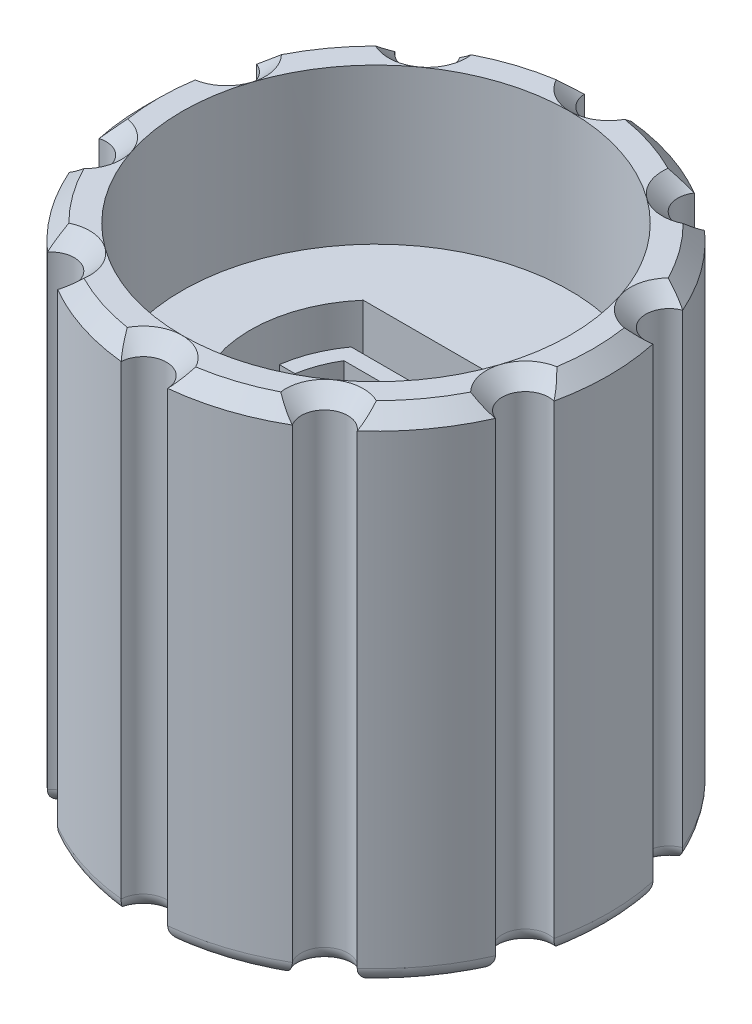
from build123d import *

# Parameters (mm, degrees)
SKETCH1_R           = 7.5
BOSS_EXTRUDE1_DEPTH = 16
CUT_EXTRUDE3_DEPTH  = 20.19635382
CHAMFER1_SIZE       = 0.5
FILLET1_R           = 0.5
CUT_EXTRUDE4_DEPTH  = 14
BOSS_EXTRUDE2_DEPTH = 8
SKETCH7_R           = 6.25
CUT_EXTRUDE5_DEPTH  = 5


with BuildPart() as part:
    # Sketch1 → Boss-Extrude1 (new body)
    with BuildSketch(Plane(origin=(0, 0, 0), x_dir=(1, 0, 0), z_dir=(0, 1, 0))):
        with Locations(Location((0, 0, 0), (0, 0, 270))):
            Circle(SKETCH1_R)
    extrude(amount=BOSS_EXTRUDE1_DEPTH)

    # Sketch4 → Cut-Extrude3 (cut, through all)
    with BuildSketch(Plane(origin=(0, 16, 0), x_dir=(1, 0, 0), z_dir=(0, 1, 0))):
        with BuildLine():
            ThreePointArc((-3.780343628, 6.477576866), (-4.408389392, 6.067627458), (-4.992351263, 5.597001775))
            ThreePointArc((-4.992351263, 5.597001775), (-3.967550453, 5.460864712), (-3.780343628, 6.477576866))
        make_face()
        with BuildLine():
            ThreePointArc((0.749061913, 7.4625), (0, 7.5), (-0.749061913, 7.4625))
            ThreePointArc((-0.749061913, 7.4625), (0, 6.75), (0.749061913, 7.4625))
        make_face()
        with BuildLine():
            ThreePointArc((3.780343628, 6.477576866), (3.967550453, 5.460864712), (4.992351263, 5.597001775))
            ThreePointArc((4.992351263, 5.597001775), (4.408389392, 6.067627458), (3.780343628, 6.477576866))
        make_face()
        with BuildLine():
            ThreePointArc((6.865786392, 3.018439534), (6.419631485, 2.085864712), (7.328732114, 1.593639107))
            ThreePointArc((7.328732114, 1.593639107), (7.132923872, 2.317627458), (6.865786392, 3.018439534))
        make_face()
        with BuildLine():
            ThreePointArc((7.328732114, -1.593639107), (6.419631485, -2.085864712), (6.865786392, -3.018439534))
            ThreePointArc((6.865786392, -3.018439534), (7.132923872, -2.317627458), (7.328732114, -1.593639107))
        make_face()
        with BuildLine():
            ThreePointArc((4.992351263, -5.597001775), (3.967550453, -5.460864712), (3.780343628, -6.477576866))
            ThreePointArc((3.780343628, -6.477576866), (4.408389392, -6.067627458), (4.992351263, -5.597001775))
        make_face()
        with BuildLine():
            ThreePointArc((-0.749061913, -7.4625), (0, -7.5), (0.749061913, -7.4625))
            ThreePointArc((0.749061913, -7.4625), (0, -6.75), (-0.749061913, -7.4625))
        make_face()
        with BuildLine():
            ThreePointArc((-4.992351263, -5.597001775), (-4.408389392, -6.067627458), (-3.780343628, -6.477576866))
            ThreePointArc((-3.780343628, -6.477576866), (-3.967550453, -5.460864712), (-4.992351263, -5.597001775))
        make_face()
        with BuildLine():
            ThreePointArc((-7.328732114, -1.593639107), (-7.132923872, -2.317627458), (-6.865786392, -3.018439534))
            ThreePointArc((-6.865786392, -3.018439534), (-6.419631485, -2.085864712), (-7.328732114, -1.593639107))
        make_face()
        with BuildLine():
            ThreePointArc((-6.865786392, 3.018439534), (-7.132923872, 2.317627458), (-7.328732114, 1.593639107))
            ThreePointArc((-7.328732114, 1.593639107), (-6.419631485, 2.085864712), (-6.865786392, 3.018439534))
        make_face()
    extrude(amount=-CUT_EXTRUDE3_DEPTH, mode=Mode.SUBTRACT)

    # Chamfer1
    chamfer1_edges = [part.edges().sort_by_distance(p)[0] for p in [
        (6.067627458, 16, 4.408389392),
        (7.5, 16, 0),
        (6.067627458, 16, -4.408389392),
        (2.317627458, 16, -7.132923872),
        (-2.317627458, 16, -7.132923872),
        (-6.067627458, 16, -4.408389392),
        (-7.5, 16, 0),
        (-6.067627458, 16, 4.408389392),
        (-2.317627458, 16, 7.132923872),
        (-6.419631485, 16, 2.085864712),
        (-3.967550453, 16, 5.460864712),
        (0, 16, 6.75),
        (2.317627458, 16, 7.132923872),
        (3.967550453, 16, 5.460864712),
        (6.419631485, 16, 2.085864712),
        (6.419631485, 16, -2.085864712),
        (3.967550453, 16, -5.460864712),
        (0, 16, -6.75),
        (-6.419631485, 16, -2.085864712),
        (-3.967550453, 16, -5.460864712),
    ]]
    chamfer(chamfer1_edges, length=CHAMFER1_SIZE)

    # Fillet1
    fillet1_edges = [part.edges().sort_by_distance(p)[0] for p in [
        (-7.5, 0, 0),
        (-6.067627458, 0, 4.408389392),
        (-2.317627458, 0, 7.132923872),
        (2.317627458, 0, 7.132923872),
        (-6.419631485, 0, 2.085864712),
        (-3.967550453, 0, 5.460864712),
        (0, 0, 6.75),
        (3.967550453, 0, 5.460864712),
        (6.419631485, 0, 2.085864712),
        (6.419631485, 0, -2.085864712),
        (3.967550453, 0, -5.460864712),
        (6.067627458, 0, 4.408389392),
        (0, 0, -6.75),
        (-6.419631485, 0, -2.085864712),
        (7.5, 0, 0),
        (-3.967550453, 0, -5.460864712),
        (6.067627458, 0, -4.408389392),
        (2.317627458, 0, -7.132923872),
        (-2.317627458, 0, -7.132923872),
        (-6.067627458, 0, -4.408389392),
    ]]
    fillet(fillet1_edges, radius=FILLET1_R)

    # Sketch5 → Cut-Extrude4 (cut)
    with BuildSketch(Plane(origin=(0, 16, 0), x_dir=(1, 0, 0), z_dir=(0, 1, 0))):
        with BuildLine():
            Line((-3.062678566, 2.65), (3.062678566, 2.65))
            ThreePointArc((3.062678566, 2.65), (0, -4.05), (-3.062678566, 2.65))
        make_face()
    extrude(amount=-CUT_EXTRUDE4_DEPTH, mode=Mode.SUBTRACT)

    # Sketch6 → Boss-Extrude2 (add)
    with BuildSketch(Plane(origin=(0, 2, 0), x_dir=(1, 0, 0), z_dir=(0, 1, 0))):
        with BuildLine():
            Line((2.949576241, 2.15), (-2.949576241, 2.15))
            ThreePointArc((-2.949576241, 2.15), (-3.384668522, 1.366206058), (-3.615591238, 0.5))
            Line((-3.615591238, 0.5), (-3.110064308, 0.5))
            ThreePointArc((-3.110064308, 0.5), (-2.953191346, 1.095974852), (-2.683281573, 1.65))
            Line((-2.683281573, 1.65), (2.683281573, 1.65))
            ThreePointArc((2.683281573, 1.65), (2.953191346, 1.095974852), (3.110064308, 0.5))
            Line((3.110064308, 0.5), (3.615591238, 0.5))
            ThreePointArc((3.615591238, 0.5), (3.384668522, 1.366206058), (2.949576241, 2.15))
        make_face()
        with BuildLine():
            Line((-3.65, 0), (-3.15, 0))
            ThreePointArc((-3.15, 0), (0, -3.15), (3.15, 0))
            Line((3.15, 0), (3.65, 0))
            ThreePointArc((3.65, 0), (0, -3.65), (-3.65, 0))
        make_face()
    extrude(amount=BOSS_EXTRUDE2_DEPTH)

    # Sketch7 → Cut-Extrude5 (cut)
    with BuildSketch(Plane(origin=(0, 16, 0), x_dir=(1, 0, 0), z_dir=(0, 1, 0))):
        with Locations(Location((0, 0, 0), (0, 0, 270))):
            Circle(SKETCH7_R)
        with BuildLine():
            Line((3.062678566, 2.65), (-3.062678566, 2.65))
            ThreePointArc((-3.062678566, 2.65), (0, -4.05), (3.062678566, 2.65))
        make_face(mode=Mode.SUBTRACT)
    extrude(amount=-CUT_EXTRUDE5_DEPTH, mode=Mode.SUBTRACT)


solid = part.part
